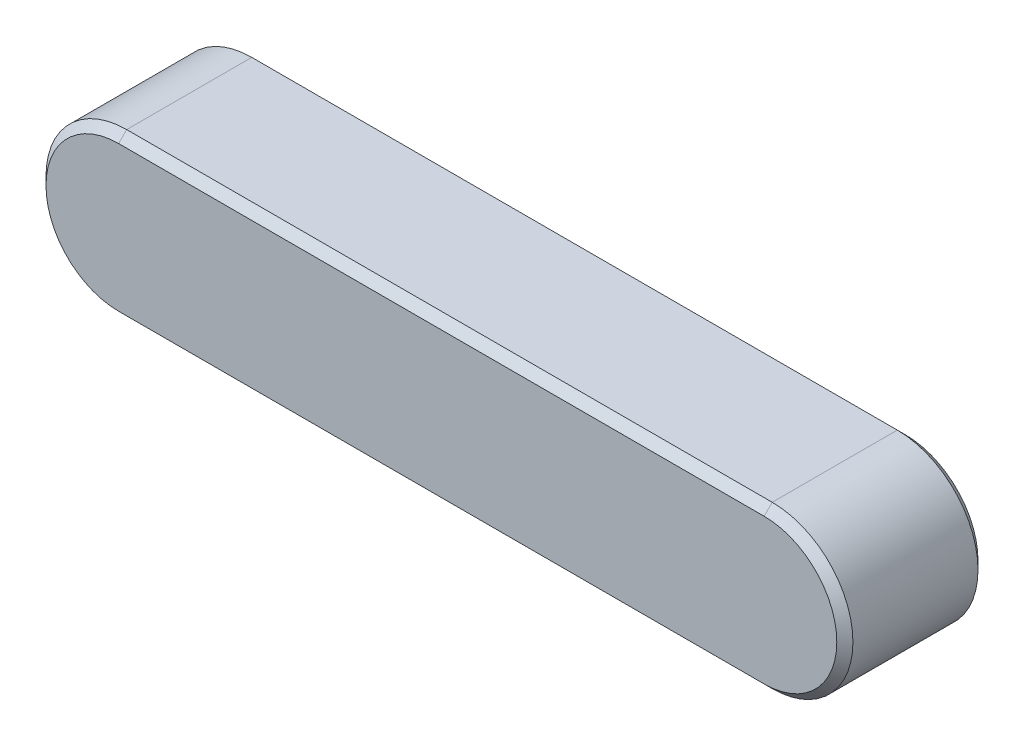
from build123d import *

# Parameters (mm, degrees)
BASEKEY_DEPTH = 3.5
CHAMFER1_SIZE = 0.4


with BuildPart() as part:
    # Sketch1 → BaseKey (new, symmetric)
    with BuildSketch(Plane.XY):
        with BuildLine():
            Line((-32, 4), (0, 4))
            ThreePointArc((0, 4), (4, 0), (0, -4))
            Line((0, -4), (-32, -4))
            ThreePointArc((-32, -4), (-36, 0), (-32, 4))
        make_face()
    extrude(amount=BASEKEY_DEPTH, both=True)

    # Chamfer1
    chamfer1_edges = [part.edges().sort_by_distance(p)[0] for p in [
        (4, 0, 3.5),
        (-16, 4, 3.5),
        (-36, 0, 3.5),
        (-16, 4, -3.5),
        (4, 0, -3.5),
        (-16, -4, -3.5),
        (-36, 0, -3.5),
        (-16, -4, 3.5),
    ]]
    chamfer(chamfer1_edges, length=CHAMFER1_SIZE)


solid = part.part
